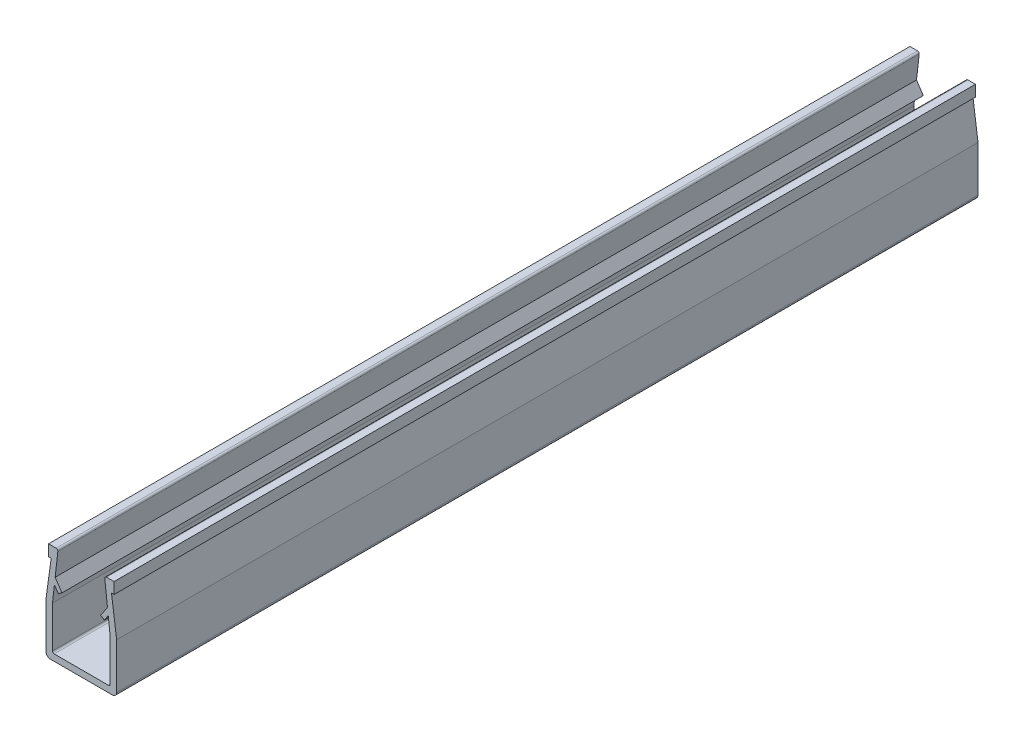
from build123d import *

# Parameters (mm, degrees)
EXTRUDE_1_DEPTH = 100


with BuildPart() as part:
    # 草图1 → 凸台-拉伸1 (new body)
    with BuildSketch(Plane.XY):
        with BuildLine():
            Line((0, -1.3), (0, 0))
            Line((0, 0), (0.876117478, 0))
            ThreePointArc((0.876117478, 0), (1.025270289, -0.066757968), (1.074851714, -0.222465609))
            Line((1.074851714, -0.222465609), (0.762425857, -2.986232805))
            Line((0.762425857, -2.986232805), (1.55, -4.165282478))
            Line((1.55, -4.165282478), (1.134225832, -4.443008676))
            Line((1.134225832, -4.443008676), (0.675396165, -3.756110847))
            Line((0.675396165, -3.756110847), (0.45, -5.75))
            Line((0.45, -5.75), (0.45, -10.55))
            ThreePointArc((0.45, -10.55), (0.508578644, -10.691421356), (0.65, -10.75))
            Line((0.65, -10.75), (6.95, -10.75))
            ThreePointArc((6.95, -10.75), (7.091421356, -10.691421356), (7.15, -10.55))
            Line((7.15, -10.55), (7.15, -5.75))
            Line((7.15, -5.75), (6.924603835, -3.756110847))
            Line((6.924603835, -3.756110847), (6.465774168, -4.443008676))
            Line((6.465774168, -4.443008676), (6.05, -4.165282478))
            Line((6.05, -4.165282478), (6.837574143, -2.986232805))
            Line((6.837574143, -2.986232805), (6.525148286, -0.222465609))
            ThreePointArc((6.525148286, -0.222465609), (6.574729711, -0.066757968), (6.723882522, 0))
            Line((6.723882522, 0), (7.6, 0))
            Line((7.6, 0), (7.6, -1.3))
            Line((7.6, -1.3), (7.30173337, -1.3))
            Line((7.30173337, -1.3), (7.9, -5.707743265))
            Line((7.9, -5.707743265), (7.9, -11))
            ThreePointArc((7.9, -11), (7.753553391, -11.353553391), (7.4, -11.5))
            Line((7.4, -11.5), (0.2, -11.5))
            ThreePointArc((0.2, -11.5), (-0.153553391, -11.353553391), (-0.3, -11))
            Line((-0.3, -11), (-0.3, -5.707743265))
            Line((-0.3, -5.707743265), (0.29826663, -1.3))
            Line((0.29826663, -1.3), (0, -1.3))
        make_face()
    extrude(amount=EXTRUDE_1_DEPTH)


solid = part.part
